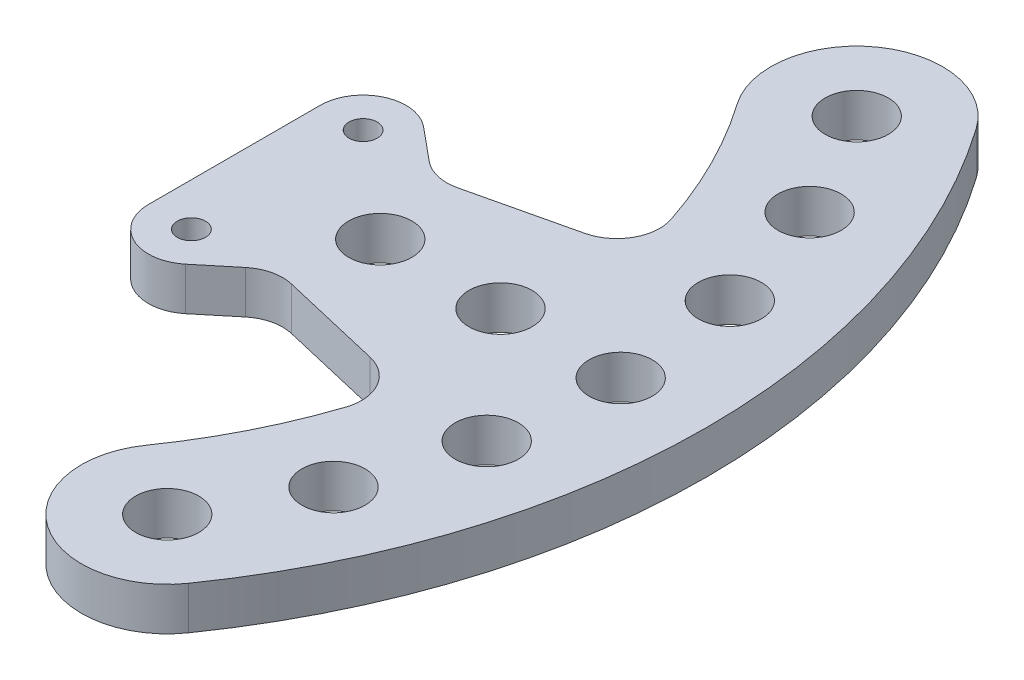
from build123d import *

# Parameters (mm, degrees)
SKETCH1_R           = 2.0828
SKETCH1_R_2         = 4.6736
BOSS_EXTRUDE1_DEPTH = 6.35


with BuildPart() as part:
    # Sketch1 → Boss-Extrude1 (new body)
    with BuildSketch(Plane(origin=(0, 0, 0), x_dir=(1, 0, 0), z_dir=(0, 1, 0))):
        with BuildLine():
            Line((67.725064599, 15.875), (52.484642113, 12.302589868))
            ThreePointArc((52.484642113, 12.302589868), (49.586387593, 12.302563925), (46.99, 13.590450074))
            Line((46.99, 13.590450074), (42.145459513, 17.594564059))
            ThreePointArc((42.145459513, 17.594564059), (35.395020139, 18.445048647), (31.75, 12.7))
            Line((31.75, 12.7), (31.75, -12.7))
            ThreePointArc((31.75, -12.7), (35.395020139, -18.445048647), (42.145459513, -17.594564059))
            Line((42.145459513, -17.594564059), (46.99, -13.590450074))
            ThreePointArc((46.99, -13.590450074), (49.586387593, -12.302563925), (52.484642113, -12.302589868))
            Line((52.484642113, -12.302589868), (67.725064599, -15.875))
            ThreePointArc((67.725064599, -15.875), (71.818943633, -18.959526957), (72.300962181, -24.062644653))
            ThreePointArc((72.300962181, -24.062644653), (68.072487407, -34.242903765), (62.419385775, -43.70652445))
            ThreePointArc((62.419385775, -43.70652445), (65.538195996, -61.394176154), (83.2258477, -58.275365933))
            ThreePointArc((83.2258477, -58.275365933), (101.6, 0), (83.2258477, 58.275365933))
            ThreePointArc((83.2258477, 58.275365933), (65.538195996, 61.394176154), (62.419385775, 43.70652445))
            ThreePointArc((62.419385775, 43.70652445), (68.072487407, 34.242903765), (72.300962181, 24.062644653))
            ThreePointArc((72.300962181, 24.062644653), (71.818943633, 18.959526957), (67.725064599, 15.875))
        make_face()
        with Locations(Location((38.1, 12.7, 0), (0, 0, 270))):
            Circle(SKETCH1_R, mode=Mode.SUBTRACT)
        with Locations(Location((88.9, 0, 0), (0, 0, 270))):
            Circle(SKETCH1_R_2, mode=Mode.SUBTRACT)
        with Locations(Location((87.063381275, -17.97714218, 0), (0, 0, 270))):
            Circle(SKETCH1_R_2, mode=Mode.SUBTRACT)
        with Locations(Location((81.629411902, -35.211491201, 0), (0, 0, 270))):
            Circle(SKETCH1_R_2, mode=Mode.SUBTRACT)
        with Locations(Location((72.822616737, -50.990945192, 0), (0, 0, 270))):
            Circle(SKETCH1_R_2, mode=Mode.SUBTRACT)
        with Locations(Location((87.063381275, 17.97714218, 0), (0, 0, 270))):
            Circle(SKETCH1_R_2, mode=Mode.SUBTRACT)
        with Locations(Location((81.629411902, 35.211491201, 0), (0, 0, 270))):
            Circle(SKETCH1_R_2, mode=Mode.SUBTRACT)
        with Locations(Location((72.822616737, 50.990945192, 0), (0, 0, 270))):
            Circle(SKETCH1_R_2, mode=Mode.SUBTRACT)
        with Locations(Location((71.12, 0, 0), (0, 0, 270))):
            Circle(SKETCH1_R_2, mode=Mode.SUBTRACT)
        with Locations(Location((53.34, 0, 0), (0, 0, 270))):
            Circle(SKETCH1_R_2, mode=Mode.SUBTRACT)
        with Locations(Location((38.1, -12.7, 0), (0, 0, 90))):
            Circle(SKETCH1_R, mode=Mode.SUBTRACT)
    extrude(amount=BOSS_EXTRUDE1_DEPTH)


solid = part.part
